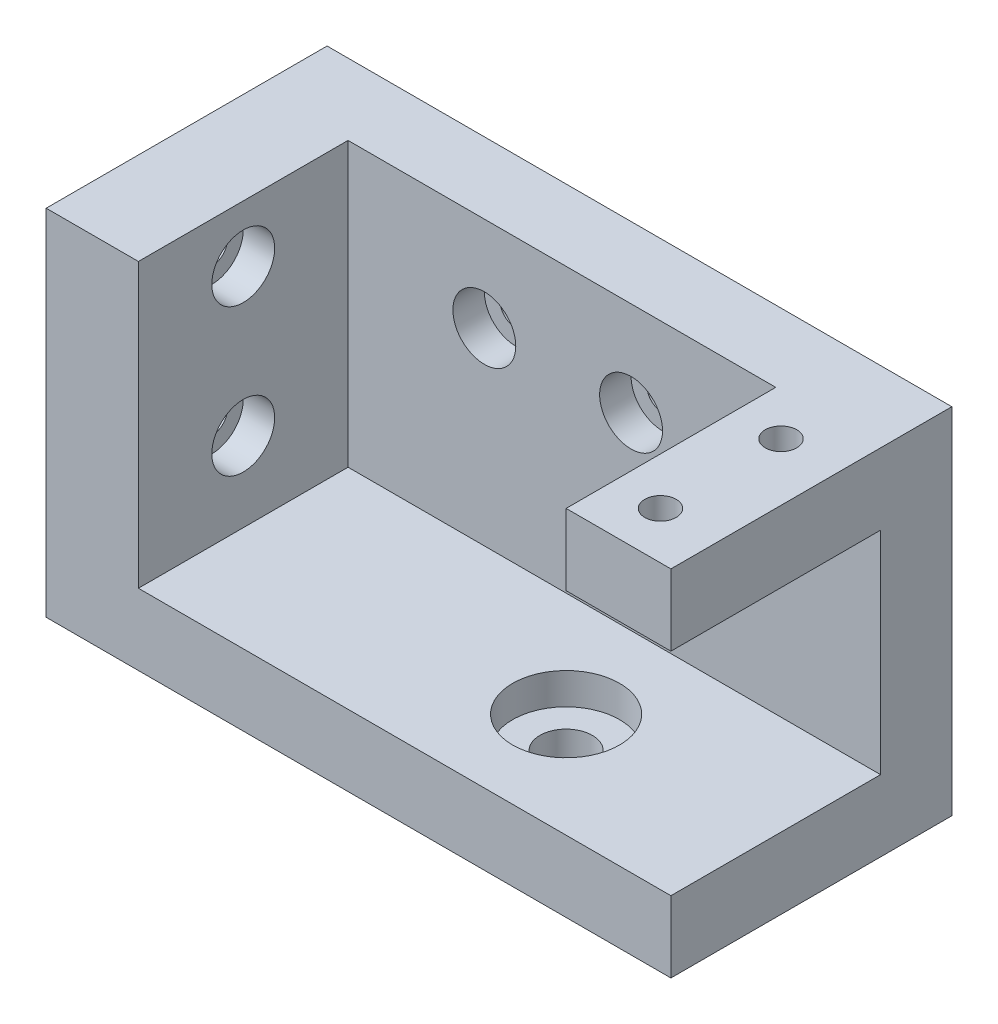
from build123d import *

# Parameters (mm, degrees)
BOSS_EXTRUDE2_DEPTH  = 20
SKETCH4_W            = 6.8
SKETCH4_H            = 33.8
BOSS_EXTRUDE3_DEPTH  = 53.6
SKETCH8_W            = 20
SKETCH8_H            = 20.2
CUT_EXTRUDE1_DEPTH   = 53.6
SKETCH9_R            = 5
CUT_EXTRUDE3_DEPTH   = 3
SKETCH11_R           = 2.5
CUT_EXTRUDE4_DEPTH   = 20
SKETCH12_R           = 1.1
CUT_EXTRUDE6_DEPTH   = 20
SKETCH13_W           = 2
SKETCH13_H           = 26.8
BOSS_EXTRUDE4_DEPTH  = 33.8
SKETCH16_R           = 1.1
CUT_EXTRUDE7_DEPTH   = 20
SKETCH17_W           = 2
SKETCH17_H           = 26.8
BOSS_EXTRUDE5_DEPTH  = 33.8
SKETCH18_W           = 20
SKETCH18_H           = 20.2
CUT_EXTRUDE9_DEPTH   = 60
SKETCH19_W           = 20
SKETCH19_H           = 20.2
CUT_EXTRUDE10_DEPTH  = 60
SKETCH20_W           = 8.8
SKETCH20_H           = 20.2
BOSS_EXTRUDE6_DEPTH  = 20
SKETCH21_R           = 1.1
BOSS_EXTRUDE7_DEPTH  = 13.6
SKETCH23_R           = 1.1
BOSS_EXTRUDE8_DEPTH  = 13.6
SKETCH24_R           = 1.125173923
BOSS_EXTRUDE9_DEPTH  = 6.8
SKETCH25_R           = 1.1
SKETCH25_R_2         = 1.440897936
BOSS_EXTRUDE10_DEPTH = 6.8
SKETCH26_R           = 1.5
CUT_EXTRUDE11_DEPTH  = 10
SKETCH27_R           = 1.5
CUT_EXTRUDE12_DEPTH  = 10
SKETCH29_R           = 1.5
CUT_EXTRUDE15_DEPTH  = 10
SKETCH31_R           = 3
CUT_EXTRUDE16_DEPTH  = 3
SKETCH32_R           = 3
CUT_EXTRUDE17_DEPTH  = 3
SKETCH33_R           = 5.1
CUT_EXTRUDE18_DEPTH  = 3
SKETCH35_W           = 6.8
SKETCH35_H           = 20.2
BOSS_EXTRUDE11_DEPTH = 2
SKETCH36_R           = 2.5
BOSS_EXTRUDE13_DEPTH = 6.8
SKETCH37_R           = 1.5
CUT_EXTRUDE19_DEPTH  = 6.8


with BuildPart() as part:
    # Sketch1 → Boss-Extrude2 (new body)
    with BuildSketch(Plane.XY):
        Polygon((-13.090120482, -4.867831325), (27.713257426, -4.867831325), (27.713257426, 21.982168675), (34.513257426, 21.982168675), (34.513257426, -5.017831325), (34.513257426, -11.817831325), (-19.890120482, -11.817831325), (-19.890120482, -5.017831325), (-19.890120482, 21.982168675), (-13.090120482, 21.982168675), align=None)
    extrude(amount=BOSS_EXTRUDE2_DEPTH)

    # Sketch4 → Boss-Extrude3 (add)
    with BuildSketch(Plane.ZY.offset(19.890120482)):
        with Locations((-3.4, 5.082168675)):
            Rectangle(SKETCH4_W, SKETCH4_H)
    extrude(amount=-BOSS_EXTRUDE3_DEPTH)

    # Sketch8 → Cut-Extrude1 (cut)
    with BuildSketch(Plane(origin=(34.513257426, 0, 0), x_dir=(0, 0, -1), z_dir=(1, 0, 0))):
        with Locations((-10, 5.082168675)):
            Rectangle(SKETCH8_W, SKETCH8_H)
    extrude(amount=-CUT_EXTRUDE1_DEPTH, mode=Mode.SUBTRACT)

    # Sketch9 → Cut-Extrude3 (cut)
    with BuildSketch(Plane(origin=(0, -5.017831325, 0), x_dir=(1, 0, 0), z_dir=(0, 1, 0))):
        with Locations(Location((17.713257426, -10, 0), (0, 0, 270))):
            Circle(SKETCH9_R)
    extrude(amount=-CUT_EXTRUDE3_DEPTH, mode=Mode.SUBTRACT)

    # Sketch11 → Cut-Extrude4 (cut)
    with BuildSketch(Plane(origin=(0, -8.017831325, 0), x_dir=(1, 0, 0), z_dir=(0, 1, 0))):
        with Locations(Location((17.713257426, -10, 0), (0, 0, 270))):
            Circle(SKETCH11_R)
    extrude(amount=-CUT_EXTRUDE4_DEPTH, mode=Mode.SUBTRACT)

    # Sketch12 → Cut-Extrude6 (cut)
    with BuildSketch(Plane(origin=(0, 21.982168675, 0), x_dir=(1, 0, 0), z_dir=(0, 1, 0))):
        with Locations(Location((32.513257426, -15.3, 0), (0, 0, 180))):
            Circle(SKETCH12_R)
        with Locations(Location((31.709879518, -4.7, 0), (0, 0, 180))):
            Circle(SKETCH12_R)
    extrude(amount=-CUT_EXTRUDE6_DEPTH, mode=Mode.SUBTRACT)

    # Sketch13 → Boss-Extrude4 (add)
    with BuildSketch(Plane(origin=(0, 21.982168675, 0), x_dir=(1, 0, 0), z_dir=(0, 1, 0))):
        with Locations((34.709879518, -6.6)):
            Rectangle(SKETCH13_W, SKETCH13_H)
    extrude(amount=-BOSS_EXTRUDE4_DEPTH)

    # Sketch16 → Cut-Extrude7 (cut)
    with BuildSketch(Plane(origin=(0, 21.982168675, 0), x_dir=(1, 0, 0), z_dir=(0, 1, 0))):
        with Locations(Location((-17.890120482, -15.3, 0), (0, 0, 180))):
            Circle(SKETCH16_R)
        with Locations(Location((-17.890120482, -4.7, 0), (0, 0, 180))):
            Circle(SKETCH16_R)
    extrude(amount=-CUT_EXTRUDE7_DEPTH, mode=Mode.SUBTRACT)

    # Sketch17 → Boss-Extrude5 (add)
    with BuildSketch(Plane(origin=(0, 21.982168675, 0), x_dir=(1, 0, 0), z_dir=(0, 1, 0))):
        with Locations((-20.890120482, -6.6)):
            Rectangle(SKETCH17_W, SKETCH17_H)
    extrude(amount=-BOSS_EXTRUDE5_DEPTH)

    # Sketch18 → Cut-Extrude9 (cut)
    with BuildSketch(Plane.ZY.offset(-33.709879518)):
        with Locations((10, 5.082168675)):
            Rectangle(SKETCH18_W, SKETCH18_H)
    extrude(amount=CUT_EXTRUDE9_DEPTH, mode=Mode.SUBTRACT)

    # Sketch19 → Cut-Extrude10 (cut)
    with BuildSketch(Plane.ZY.offset(-33.709879518)):
        with Locations((10, 5.082168675)):
            Rectangle(SKETCH19_W, SKETCH19_H)
    extrude(amount=-CUT_EXTRUDE10_DEPTH, mode=Mode.SUBTRACT)

    # Sketch20 → Boss-Extrude6 (add)
    with BuildSketch(Plane.XY):
        with Locations((-17.490120482, 5.082168675)):
            Rectangle(SKETCH20_W, SKETCH20_H)
    extrude(amount=BOSS_EXTRUDE6_DEPTH)

    # Sketch21 → Boss-Extrude7 (add)
    with BuildSketch(Plane(origin=(0, 21.982168675, 0), x_dir=(1, 0, 0), z_dir=(0, 1, 0))):
        with Locations((-17.890120482, -4.7)):
            Circle(SKETCH21_R)
    extrude(amount=-BOSS_EXTRUDE7_DEPTH)

    # Sketch23 → Boss-Extrude8 (add)
    with BuildSketch(Plane(origin=(0, 21.982168675, 0), x_dir=(1, 0, 0), z_dir=(0, 1, 0))):
        with Locations((-17.890120482, -15.3)):
            Circle(SKETCH23_R)
    extrude(amount=-BOSS_EXTRUDE8_DEPTH)

    # Sketch24 → Boss-Extrude9 (add)
    with BuildSketch(Plane(origin=(0, 21.982168675, 0), x_dir=(1, 0, 0), z_dir=(0, 1, 0))):
        with Locations((32.513257426, -15.3)):
            Circle(SKETCH24_R)
    extrude(amount=-BOSS_EXTRUDE9_DEPTH)

    # Sketch25 → Boss-Extrude10 (add)
    with BuildSketch(Plane(origin=(0, 21.982168675, 0), x_dir=(1, 0, 0), z_dir=(0, 1, 0))):
        with Locations((29.715206423, -15.150513528)):
            Circle(SKETCH25_R)
        with Locations((31.709879518, -4.7)):
            Circle(SKETCH25_R_2)
    extrude(amount=-BOSS_EXTRUDE10_DEPTH)

    # Sketch26 → Cut-Extrude11 (cut)
    with BuildSketch(Plane(origin=(0, 21.982168675, 0), x_dir=(1, 0, 0), z_dir=(0, 1, 0))):
        with Locations(Location((32.213257426, -4.5, 0), (0, 0, 180))):
            Circle(SKETCH26_R)
        with Locations(Location((32.213257426, -15.5, 0), (0, 0, 180))):
            Circle(SKETCH26_R)
    extrude(amount=-CUT_EXTRUDE11_DEPTH, mode=Mode.SUBTRACT)

    # Sketch27 → Cut-Extrude12 (cut)
    with BuildSketch(Plane(origin=(0, 0, -6.8), x_dir=(-1, 0, 0), z_dir=(0, 0, -1))):
        with Locations(Location((-13.909879518, 12.982168675, 0), (0, 0, 90))):
            Circle(SKETCH27_R)
        with Locations(Location((0.090120482, 12.982168675, 0), (0, 0, 90))):
            Circle(SKETCH27_R)
    extrude(amount=-CUT_EXTRUDE12_DEPTH, mode=Mode.SUBTRACT)

    # Sketch29 → Cut-Extrude15 (cut)
    with BuildSketch(Plane.ZY.offset(21.890120482)):
        with Locations(Location((10, 2.582168675, 0), (0, 0, 270))):
            Circle(SKETCH29_R)
        with Locations(Location((10, 16.582168675, 0), (0, 0, 270))):
            Circle(SKETCH29_R)
    extrude(amount=-CUT_EXTRUDE15_DEPTH, mode=Mode.SUBTRACT)

    # Sketch31 → Cut-Extrude16 (cut)
    with BuildSketch(Plane(origin=(-13.090120482, 0, 0), x_dir=(0, 0, -1), z_dir=(1, 0, 0))):
        with Locations(Location((-10, 2.582168675, 0), (0, 0, 90))):
            Circle(SKETCH31_R)
        with Locations(Location((-10, 16.582168675, 0), (0, 0, 90))):
            Circle(SKETCH31_R)
    extrude(amount=-CUT_EXTRUDE16_DEPTH, mode=Mode.SUBTRACT)

    # Sketch32 → Cut-Extrude17 (cut)
    with BuildSketch(Plane.XY):
        with Locations((-0.090120482, 12.982168675)):
            Circle(SKETCH32_R)
        with Locations((13.909879518, 12.982168675)):
            Circle(SKETCH32_R)
    extrude(amount=-CUT_EXTRUDE17_DEPTH, mode=Mode.SUBTRACT)

    # Sketch33 → Cut-Extrude18 (cut)
    with BuildSketch(Plane(origin=(0, -5.017831325, 0), x_dir=(1, 0, 0), z_dir=(0, 1, 0))):
        with Locations(Location((17.713257426, -10, 0), (0, 0, 270))):
            Circle(SKETCH33_R)
    extrude(amount=-CUT_EXTRUDE18_DEPTH, mode=Mode.SUBTRACT)

    # Sketch35 → Boss-Extrude11 (add)
    with BuildSketch(Plane(origin=(35.709879518, 0, 0), x_dir=(0, 0, -1), z_dir=(1, 0, 0))):
        Polygon((-20, 21.982168675), (-20, 15.182168675), (0, 15.182168675), (6.8, 15.182168675), (6.8, 21.982168675), align=None)
        with Locations((3.4, 5.082168675)):
            Rectangle(SKETCH35_W, SKETCH35_H)
        Polygon((6.8, -5.017831325), (0, -5.017831325), (-20, -5.017831325), (-20, -11.817831325), (6.8, -11.817831325), align=None)
    extrude(amount=BOSS_EXTRUDE11_DEPTH)

    # Sketch36 → Boss-Extrude13 (add)
    with BuildSketch(Plane(origin=(0, 21.982168675, 0), x_dir=(1, 0, 0), z_dir=(0, 1, 0))):
        with Locations((31.713257426, -4)):
            Circle(SKETCH36_R)
    extrude(amount=-BOSS_EXTRUDE13_DEPTH)

    # Sketch37 → Cut-Extrude19 (cut)
    with BuildSketch(Plane(origin=(0, 21.982168675, 0), x_dir=(1, 0, 0), z_dir=(0, 1, 0))):
        with Locations(Location((32.213257426, -4, 0), (0, 0, 180))):
            Circle(SKETCH37_R)
    extrude(amount=-CUT_EXTRUDE19_DEPTH, mode=Mode.SUBTRACT)


solid = part.part
